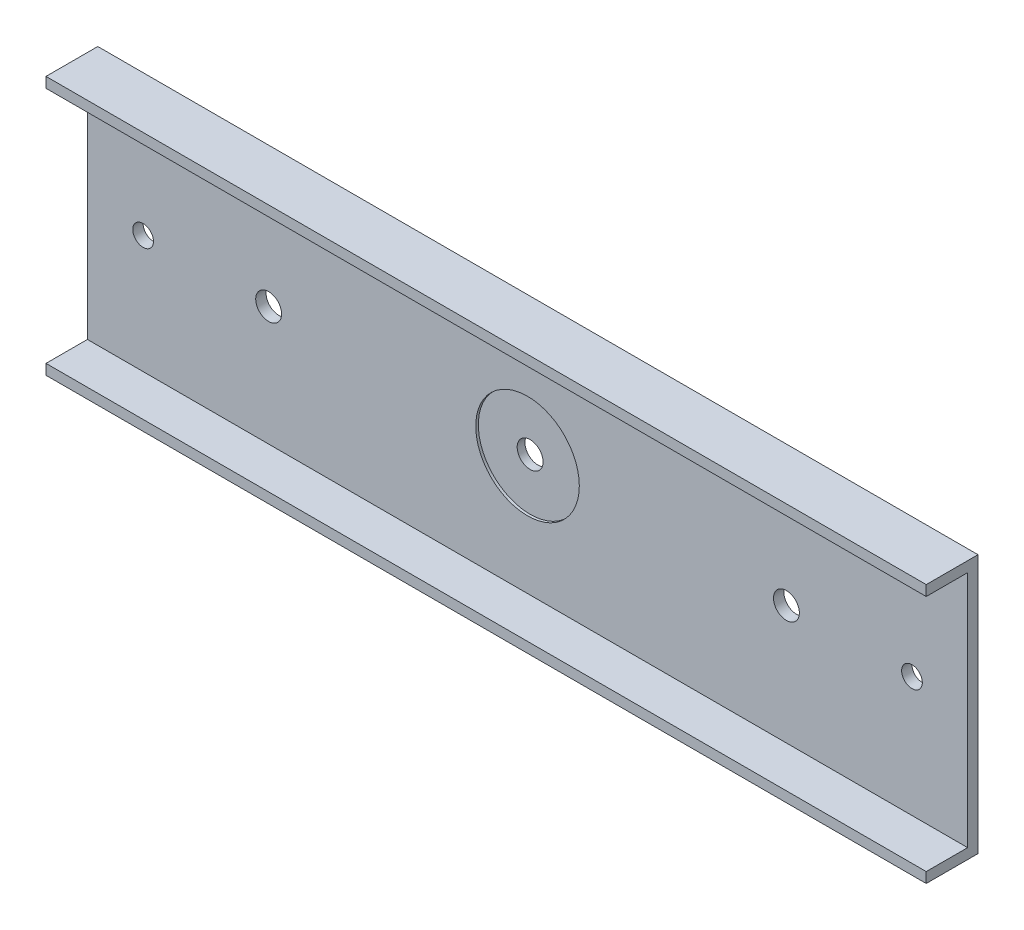
from build123d import *

# Parameters (mm, degrees)
SKETCH1_W           = 170
SKETCH1_H           = 50
BOSS_EXTRUDE1_DEPTH = 2
SKETCH2_W           = 170
SKETCH2_H           = 10
BOSS_EXTRUDE2_DEPTH = 2
SKETCH3_W           = 170
SKETCH3_H           = 10
BOSS_EXTRUDE3_DEPTH = 2
SKETCH4_R           = 2.5
CUT_EXTRUDE1_DEPTH  = 2
SKETCH5_R           = 10
CUT_EXTRUDE2_DEPTH  = 0.5
SKETCH7_R           = 2
CUT_EXTRUDE4_DEPTH  = 30


with BuildPart() as part:
    # Sketch1 → Boss-Extrude1 (new body)
    with BuildSketch(Plane.XY):
        Rectangle(SKETCH1_W, SKETCH1_H)
    extrude(amount=BOSS_EXTRUDE1_DEPTH)

    # Sketch2 → Boss-Extrude2 (add)
    with BuildSketch(Plane(origin=(0, 25, 0), x_dir=(1, 0, 0), z_dir=(0, 1, 0))):
        with Locations((0, -5)):
            Rectangle(SKETCH2_W, SKETCH2_H)
    extrude(amount=-BOSS_EXTRUDE2_DEPTH)

    # Sketch3 → Boss-Extrude3 (add)
    with BuildSketch(Plane.XZ.offset(25)):
        with Locations((0, 5)):
            Rectangle(SKETCH3_W, SKETCH3_H)
    extrude(amount=-BOSS_EXTRUDE3_DEPTH)

    # Sketch4 → Cut-Extrude1 (cut)
    with BuildSketch(Plane(origin=(0, 0, 0), x_dir=(-1, 0, 0), z_dir=(0, 0, -1))):
        Circle(SKETCH4_R)
        with Locations((-50, 0)):
            Circle(SKETCH4_R)
        with Locations((50, 0)):
            Circle(SKETCH4_R)
    extrude(amount=-CUT_EXTRUDE1_DEPTH, mode=Mode.SUBTRACT)

    # Sketch5 → Cut-Extrude2 (cut)
    with BuildSketch(Plane.XY.offset(2)):
        Circle(SKETCH5_R)
    extrude(amount=-CUT_EXTRUDE2_DEPTH, mode=Mode.SUBTRACT)

    # Sketch7 → Cut-Extrude4 (cut)
    with BuildSketch(Plane(origin=(0, 0, 0), x_dir=(-1, 0, 0), z_dir=(0, 0, -1))):
        with Locations((-74.245869062, 0.225670703)):
            Circle(SKETCH7_R)
        with Locations((74.245869062, -0.225670703)):
            Circle(SKETCH7_R)
    extrude(amount=-CUT_EXTRUDE4_DEPTH, mode=Mode.SUBTRACT)


solid = part.part
